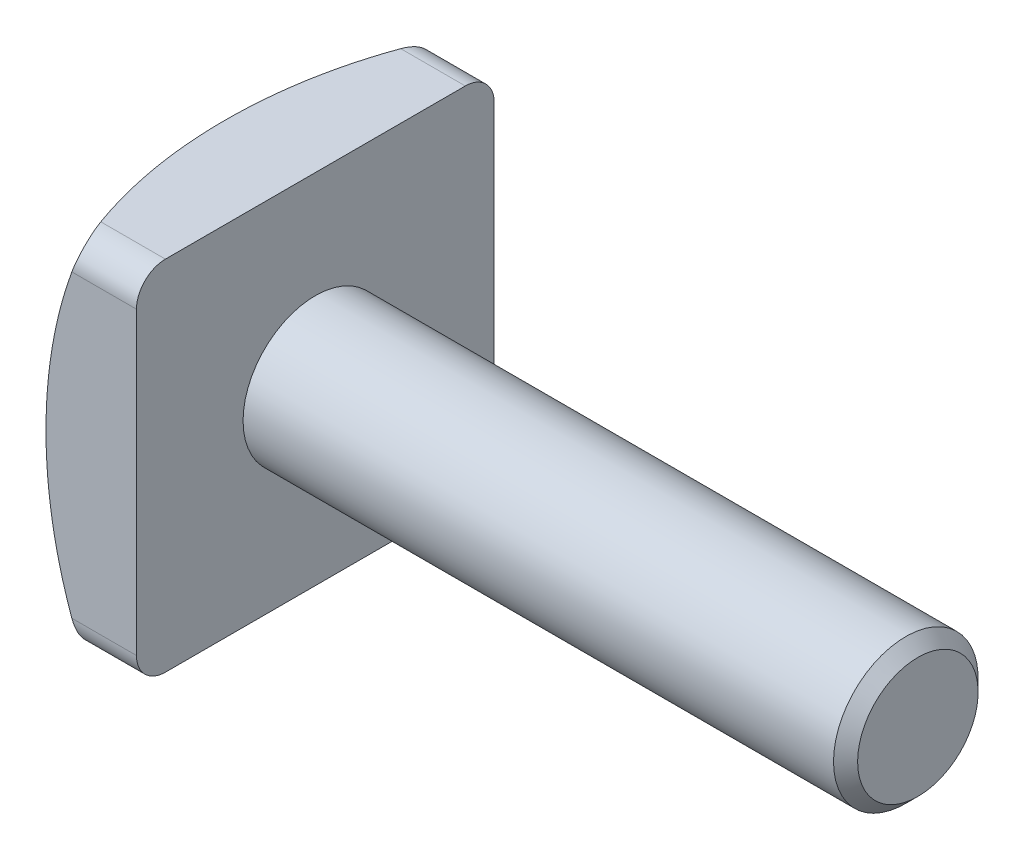
from build123d import *

# Parameters (mm, degrees)
ESQUISSE2_R             = 12.439656977
ENL_V_MAT_EXTRU_1_DEPTH = 33.26453161


with BuildPart() as part:
    # Esquisse1 → Révolution1 (revolve)
    with BuildSketch(Plane.XY):
        Polygon((0, 3), (0, 10), (-4, 10), (-4, 0), (25, 0), (25, 2.5), (24.5, 3), align=None)
    revolve(axis=Axis((-17.165934066, 0, 0), (1, 0, 0)))

    # Esquisse2 → Enlèv. mat.-Extru.1 (cut, through all)
    with BuildSketch(Plane.ZY.offset(4)):
        Circle(ESQUISSE2_R)
        with BuildLine():
            Line((6.222539674, 7.422539674), (-6.222539674, 7.422539674))
            ThreePointArc((-6.222539674, 7.422539674), (-7.071067812, 7.071067812), (-7.422539674, 6.222539674))
            Line((-7.422539674, 6.222539674), (-7.422539674, -6.222539674))
            ThreePointArc((-7.422539674, -6.222539674), (-7.071067812, -7.071067812), (-6.222539674, -7.422539674))
            Line((-6.222539674, -7.422539674), (6.222539674, -7.422539674))
            ThreePointArc((6.222539674, -7.422539674), (7.071067812, -7.071067812), (7.422539674, -6.222539674))
            Line((7.422539674, -6.222539674), (7.422539674, 6.222539674))
            ThreePointArc((7.422539674, 6.222539674), (7.071067812, 7.071067812), (6.222539674, 7.422539674))
        make_face(mode=Mode.SUBTRACT)
    extrude(amount=-ENL_V_MAT_EXTRU_1_DEPTH, mode=Mode.SUBTRACT)

    # Esquisse3 → Enlèvement de matière-Révolution1 (revolve, cut)
    with BuildSketch(Plane.XY):
        with BuildLine():
            Line((-2.5, 10), (-4.5, 10))
            Line((-4.5, 10), (-4.5, 5.049826293))
            ThreePointArc((-4.5, 5.049826293), (-3.684552713, 7.599477283), (-2.5, 10))
        make_face()
    revolve(axis=Axis((-8.516023748, 0, 0), (1, 0, 0)), mode=Mode.SUBTRACT)


solid = part.part
